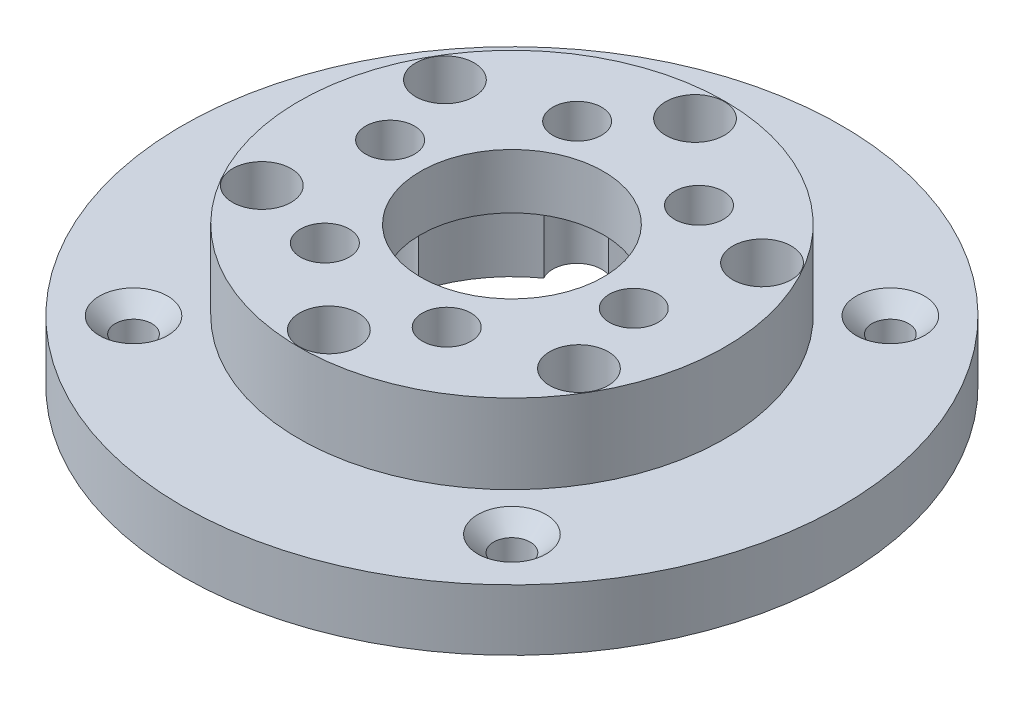
from build123d import *

# Parameters (mm, degrees)
SKETCH1_R           = 27
BOSS_EXTRUDE1_DEPTH = 5
SKETCH3_R           = 17.45
BOSS_EXTRUDE2_DEPTH = 6.5
SKETCH4_R           = 11
CUT_EXTRUDE1_DEPTH  = 7
SKETCH7_R           = 1.5
CUT_EXTRUDE2_DEPTH  = 40.877938763
SKETCH8_R           = 7.5
CUT_EXTRUDE3_DEPTH  = 40.877938763
CHAMFER1_SIZE       = 1.3
SKETCH9_R           = 2.4
CUT_EXTRUDE4_DEPTH  = 15
CUT_EXTRUDE5_REACH  = 41.878
SKETCH10_R          = 2


with BuildPart() as part:
    # Sketch1 → Boss-Extrude1 (new body)
    with BuildSketch(Plane(origin=(0, 0, 0), x_dir=(1, 0, 0), z_dir=(0, 1, 0))):
        with Locations(Location((0, 0, 0), (0, 0, 270))):
            Circle(SKETCH1_R)
    extrude(amount=BOSS_EXTRUDE1_DEPTH)

    # Sketch3 → Boss-Extrude2 (add)
    with BuildSketch(Plane(origin=(0, 5, 0), x_dir=(1, 0, 0), z_dir=(0, 1, 0))):
        with Locations(Location((0, 0, 0), (0, 0, 90))):
            Circle(SKETCH3_R)
    extrude(amount=BOSS_EXTRUDE2_DEPTH)

    # Sketch4 → Cut-Extrude1 (cut)
    with BuildSketch(Plane.XZ):
        with Locations(Location((0, 0, 0), (0, 0, 270))):
            Circle(SKETCH4_R)
    extrude(amount=-CUT_EXTRUDE1_DEPTH, mode=Mode.SUBTRACT)

    # Sketch7 → Cut-Extrude2 (cut, through all)
    with BuildSketch(Plane.XZ):
        with Locations(Location((-15.5, 15.5, 0), (0, 0, 270))):
            Circle(SKETCH7_R)
        with Locations(Location((15.5, 15.5, 0), (0, 0, 270))):
            Circle(SKETCH7_R)
        with Locations(Location((15.5, -15.5, 0), (0, 0, 270))):
            Circle(SKETCH7_R)
        with Locations(Location((-15.5, -15.5, 0), (0, 0, 270))):
            Circle(SKETCH7_R)
    extrude(amount=-CUT_EXTRUDE2_DEPTH, mode=Mode.SUBTRACT)

    # Sketch8 → Cut-Extrude3 (cut, through all)
    with BuildSketch(Plane(origin=(0, 11.5, 0), x_dir=(1, 0, 0), z_dir=(0, 1, 0))):
        with Locations(Location((0, 0, 0), (0, 0, 270))):
            Circle(SKETCH8_R)
    extrude(amount=-CUT_EXTRUDE3_DEPTH, mode=Mode.SUBTRACT)

    # Chamfer1
    chamfer1_edges = [part.edges().sort_by_distance(p)[0] for p in [
        (-15.5, 5, -14),
        (15.5, 5, -14),
        (15.5, 5, 17),
        (-15.5, 5, 17),
    ]]
    chamfer(chamfer1_edges, length=CHAMFER1_SIZE)

    # Sketch9 → Cut-Extrude4 (cut)
    with BuildSketch(Plane(origin=(0, 11.5, 0), x_dir=(1, 0, 0), z_dir=(0, 1, 0))):
        with Locations(Location((0, 15, 0), (0, 0, 270))):
            Circle(SKETCH9_R)
        with Locations(Location((12.990381057, 7.5, 0), (0, 0, 270))):
            Circle(SKETCH9_R)
        with Locations(Location((12.990381057, -7.5, 0), (0, 0, 270))):
            Circle(SKETCH9_R)
        with Locations(Location((0, -15, 0), (0, 0, 270))):
            Circle(SKETCH9_R)
        with Locations(Location((-12.990381057, -7.5, 0), (0, 0, 270))):
            Circle(SKETCH9_R)
        with Locations(Location((-12.990381057, 7.5, 0), (0, 0, 270))):
            Circle(SKETCH9_R)
    extrude(amount=-CUT_EXTRUDE4_DEPTH, mode=Mode.SUBTRACT)

    # Sketch10 → Cut-Extrude5 (cut, up to next)
    with BuildSketch(Plane.XZ, mode=Mode.PRIVATE) as cut_extrude5_sk1:
        with Locations(Location((4.633375967, 9.976563895, 0), (0, 0, 329.872709141))):
            Circle(SKETCH10_R)
    cut_extrude5_tool1 = extrude(cut_extrude5_sk1.sketch, amount=-CUT_EXTRUDE5_REACH, mode=Mode.PRIVATE) & part.part
    # Sketch10 → Cut-Extrude5 (cut, up to next)
    with BuildSketch(Plane.XZ, mode=Mode.PRIVATE) as cut_extrude5_sk2:
        with Locations(Location((10.956645759, 0.975660655, 0), (0, 0, 269.872709141))):
            Circle(SKETCH10_R)
    cut_extrude5_tool2 = extrude(cut_extrude5_sk2.sketch, amount=-CUT_EXTRUDE5_REACH, mode=Mode.PRIVATE) & part.part
    # Sketch10 → Cut-Extrude5 (cut, up to next)
    with BuildSketch(Plane.XZ, mode=Mode.PRIVATE) as cut_extrude5_sk3:
        with Locations(Location((6.323269792, -9.00090324, 0), (0, 0, 209.872709141))):
            Circle(SKETCH10_R)
    cut_extrude5_tool3 = extrude(cut_extrude5_sk3.sketch, amount=-CUT_EXTRUDE5_REACH, mode=Mode.PRIVATE) & part.part
    # Sketch10 → Cut-Extrude5 (cut, up to next)
    with BuildSketch(Plane.XZ, mode=Mode.PRIVATE) as cut_extrude5_sk4:
        with Locations(Location((-4.633375967, -9.976563895, 0), (0, 0, 340.304526282))):
            Circle(SKETCH10_R)
    cut_extrude5_tool4 = extrude(cut_extrude5_sk4.sketch, amount=-CUT_EXTRUDE5_REACH, mode=Mode.PRIVATE) & part.part
    # Sketch10 → Cut-Extrude5 (cut, up to next)
    with BuildSketch(Plane.XZ, mode=Mode.PRIVATE) as cut_extrude5_sk5:
        with Locations(Location((-10.956645759, -0.975660655, 0), (0, 0, 280.304526282))):
            Circle(SKETCH10_R)
    cut_extrude5_tool5 = extrude(cut_extrude5_sk5.sketch, amount=-CUT_EXTRUDE5_REACH, mode=Mode.PRIVATE) & part.part
    # Sketch10 → Cut-Extrude5 (cut, up to next)
    with BuildSketch(Plane.XZ, mode=Mode.PRIVATE) as cut_extrude5_sk6:
        with Locations(Location((-6.323269792, 9.00090324, 0), (0, 0, 220.304526282))):
            Circle(SKETCH10_R)
    cut_extrude5_tool6 = extrude(cut_extrude5_sk6.sketch, amount=-CUT_EXTRUDE5_REACH, mode=Mode.PRIVATE) & part.part
    add(cut_extrude5_tool1.solids().sort_by_distance((4.633376, 0, 9.976564))[0], mode=Mode.SUBTRACT)
    add(cut_extrude5_tool2.solids().sort_by_distance((10.956646, 0, 0.975661))[0], mode=Mode.SUBTRACT)
    add(cut_extrude5_tool3.solids().sort_by_distance((6.32327, 0, -9.000903))[0], mode=Mode.SUBTRACT)
    add(cut_extrude5_tool4.solids().sort_by_distance((-4.633376, 0, -9.976564))[0], mode=Mode.SUBTRACT)
    add(cut_extrude5_tool5.solids().sort_by_distance((-10.956646, 0, -0.975661))[0], mode=Mode.SUBTRACT)
    add(cut_extrude5_tool6.solids().sort_by_distance((-6.32327, 0, 9.000903))[0], mode=Mode.SUBTRACT)


solid = part.part
